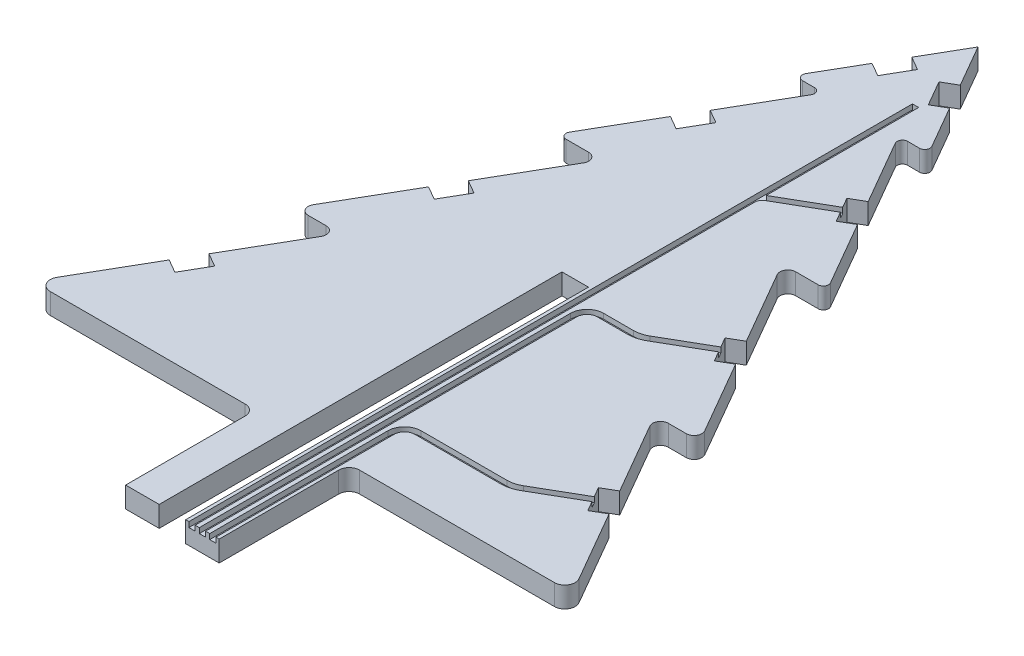
from build123d import *

# Parameters (mm, degrees)
ESBO_O1_W             = 18
ESBO_O1_H             = 25
RVORE_DEPTH           = 4
ESBO_O2_W             = 5.1
ESBO_O2_H             = 77.5
ENCAIXE_DEPTH         = 5
FILETE2_R             = 1
FILETE3_R             = 1
FILETE4_R             = 1
FILETE5_R             = 1
FILETE6_R             = 1
FILETE7_R             = 1
FILETE8_R             = 1.5
FILETE9_R             = 1.5
FILETE10_R            = 1.5
FILETE11_R            = 1.5
FILETE12_R            = 2
FILETE13_R            = 2
FILETE14_R            = 2
FILETE15_R            = 2
FILETE16_R            = 1.5
FILETE17_R            = 1.5
CORTES_DO_LED_DEPTH   = 10
ESBO_O6_W             = 16.486143217
ESBO_O6_H             = 1.199999983
ESBO_O6_W_2           = 1.200000015
ESBO_O6_H_2           = 34.2751352
ESBO_O6_W_3           = 5.711274815
ESBO_O6_H_3           = 1.2
ESBO_O6_W_4           = 1.2
ESBO_O6_H_4           = 71.40185633
CORTE_EXTRUS_O4_DEPTH = 1
FILETE18_R            = 1.5


with BuildPart() as part:
    # Esboço1 → rvore (new body)
    with BuildSketch(Plane(origin=(0, 0, 0), x_dir=(1, 0, 0), z_dir=(0, 1, 0))):
        with Locations((0, -127.5)):
            Rectangle(ESBO_O1_W, ESBO_O1_H)
        Polygon((-51.961524227, -115), (-9, -115), (9, -115), (51.961524227, -115), (30.310889132, -77.5), (-30.310889132, -77.5), align=None)
        Polygon((-8.660254038, -40), (-30.310889132, -77.5), (30.310889132, -77.5), (8.660254038, -40), align=None)
        Polygon((-17.320508076, -40), (-8.660254038, -40), (0, -25), (8.660254038, -40), (17.320508076, -40), (0, -10), align=None)
        Polygon((8.660254038, -40), (30.310889132, -77.5), (38.97114317, -77.5), (17.320508076, -40), align=None)
        Polygon((0, -25), (-8.660254038, -40), (8.660254038, -40), align=None)
        Polygon((-38.97114317, -77.5), (-30.310889132, -77.5), (-8.660254038, -40), (-17.320508076, -40), align=None)
        Polygon((-25.980762114, -40), (-17.320508076, -40), (0, -10), (17.320508076, -40), (25.980762114, -40), (7.216878365, -7.5), (-7.216878365, -7.5), align=None)
        Polygon((0, 5), (-7.216878365, -7.5), (7.216878365, -7.5), align=None)
        Polygon((-12.990381057, -7.5), (-7.216878365, -7.5), (0, 5), (7.216878365, -7.5), (12.990381057, -7.5), (0, 15), align=None)
    extrude(amount=RVORE_DEPTH)

    # Esboço2 → Encaixe (cut)
    with BuildSketch(Plane(origin=(0, 4, 0), x_dir=(1, 0, 0), z_dir=(0, 1, 0))):
        with Locations((0, -101.25)):
            Rectangle(ESBO_O2_W, ESBO_O2_H)
    extrude(amount=-ENCAIXE_DEPTH, mode=Mode.SUBTRACT)

    # Filete2
    filete2_edges = [part.edges().sort_by_distance(p)[0] for p in [
        (12.990381057, 2, 7.5),
    ]]
    fillet(filete2_edges, radius=FILETE2_R)

    # Filete3
    filete3_edges = [part.edges().sort_by_distance(p)[0] for p in [
        (-12.990381057, 2, 7.5),
    ]]
    fillet(filete3_edges, radius=FILETE3_R)

    # Filete4
    filete4_edges = [part.edges().sort_by_distance(p)[0] for p in [
        (-7.216878365, 2, 7.5),
    ]]
    fillet(filete4_edges, radius=FILETE4_R)

    # Filete5
    filete5_edges = [part.edges().sort_by_distance(p)[0] for p in [
        (7.216878365, 2, 7.5),
    ]]
    fillet(filete5_edges, radius=FILETE5_R)

    # Filete6
    filete6_edges = [part.edges().sort_by_distance(p)[0] for p in [
        (25.980762114, 2, 40),
    ]]
    fillet(filete6_edges, radius=FILETE6_R)

    # Filete7
    filete7_edges = [part.edges().sort_by_distance(p)[0] for p in [
        (-25.980762114, 2, 40),
    ]]
    fillet(filete7_edges, radius=FILETE7_R)

    # Filete8
    filete8_edges = [part.edges().sort_by_distance(p)[0] for p in [
        (17.320508076, 2, 40),
    ]]
    fillet(filete8_edges, radius=FILETE8_R)

    # Filete9
    filete9_edges = [part.edges().sort_by_distance(p)[0] for p in [
        (-17.320508076, 2, 40),
    ]]
    fillet(filete9_edges, radius=FILETE9_R)

    # Filete10
    filete10_edges = [part.edges().sort_by_distance(p)[0] for p in [
        (38.97114317, 2, 77.5),
    ]]
    fillet(filete10_edges, radius=FILETE10_R)

    # Filete11
    filete11_edges = [part.edges().sort_by_distance(p)[0] for p in [
        (-38.97114317, 2, 77.5),
    ]]
    fillet(filete11_edges, radius=FILETE11_R)

    # Filete12
    filete12_edges = [part.edges().sort_by_distance(p)[0] for p in [
        (51.961524227, 2, 115),
    ]]
    fillet(filete12_edges, radius=FILETE12_R)

    # Filete13
    filete13_edges = [part.edges().sort_by_distance(p)[0] for p in [
        (-51.961524227, 2, 115),
    ]]
    fillet(filete13_edges, radius=FILETE13_R)

    # Filete14
    filete14_edges = [part.edges().sort_by_distance(p)[0] for p in [
        (9, 2, 115),
    ]]
    fillet(filete14_edges, radius=FILETE14_R)

    # Filete15
    filete15_edges = [part.edges().sort_by_distance(p)[0] for p in [
        (-9, 2, 115),
    ]]
    fillet(filete15_edges, radius=FILETE15_R)

    # Filete16
    filete16_edges = [part.edges().sort_by_distance(p)[0] for p in [
        (30.310889132, 2, 77.5),
    ]]
    fillet(filete16_edges, radius=FILETE16_R)

    # Filete17
    filete17_edges = [part.edges().sort_by_distance(p)[0] for p in [
        (-30.310889132, 2, 77.5),
    ]]
    fillet(filete17_edges, radius=FILETE17_R)

    # Esboço5 → Cortes do Led (cut)
    with BuildSketch(Plane(origin=(0, 4, 0), x_dir=(1, 0, 0), z_dir=(0, 1, 0))):
        Polygon((42.319473419, -98.299478112), (39.519473419, -93.449735851), (36.921397208, -94.949735851), (39.721397208, -99.799478112), align=None)
        Polygon((29.544605065, -61.172757061), (26.744605065, -56.3230148), (24.146528853, -57.8230148), (26.946528853, -62.672757061), align=None)
        Polygon((17.99973671, -26.176458504), (15.19973671, -21.326716243), (12.601660498, -22.826716243), (15.401660498, -27.676458504), align=None)
        Polygon((7.461855653, 2.07568689), (4.661855653, 6.925429151), (2.063779442, 5.425429151), (4.863779442, 0.57568689), align=None)
        Polygon((-7.461855653, 2.07568689), (-4.661855653, 6.925429151), (-2.063779442, 5.425429151), (-4.863779442, 0.57568689), align=None)
        Polygon((-17.99973671, -26.176458504), (-15.19973671, -21.326716243), (-12.601660498, -22.826716243), (-15.401660498, -27.676458504), align=None)
        Polygon((-29.544605065, -61.172757061), (-26.744605065, -56.3230148), (-24.146528853, -57.8230148), (-26.946528853, -62.672757061), align=None)
        Polygon((-42.319473419, -98.299478112), (-39.519473419, -93.449735851), (-36.921397208, -94.949735851), (-39.721397208, -99.799478112), align=None)
    extrude(amount=-CORTES_DO_LED_DEPTH, mode=Mode.SUBTRACT)

    # Esboço6 → Corte-extrusão4 (cut)
    with BuildSketch(Plane(origin=(0, 4, 0), x_dir=(1, 0, 0), z_dir=(0, 1, 0))):
        with BuildLine():
            Line((26.861143157, -102.524864809), (26.861143157, -103.724864792))
            ThreePointArc((26.861143157, -103.724864792), (28.465821261, -103.513604912), (29.96114317, -102.894222224))
            Line((29.96114317, -102.894222224), (29.36114317, -101.854991739))
            ThreePointArc((29.36114317, -101.854991739), (28.155238411, -102.354493936), (26.861143157, -102.524864809))
        make_face()
        with Locations((18.618071549, -103.124864801)):
            Rectangle(ESBO_O6_W, ESBO_O6_H)
        Polygon((38.021397208, -96.854991739), (29.36114317, -101.854991739), (29.96114317, -102.894222224), (38.621397208, -97.894222224), align=None)
        with BuildLine():
            ThreePointArc((10.37499994, -103.724864792), (8.960786372, -104.310651232), (8.375000015, -105.7248648))
            Line((8.375000015, -105.7248648), (7.175, -105.7248648))
            ThreePointArc((7.175, -105.7248648), (8.112258246, -103.462123106), (10.37499994, -102.524864809))
            Line((10.37499994, -102.524864809), (10.37499994, -103.724864792))
        make_face()
        with Locations((7.775000008, -122.8624324)):
            Rectangle(ESBO_O6_W_2, ESBO_O6_H_2)
        Polygon((25.246528853, -59.728270689), (16.586274815, -64.728270689), (17.186274815, -65.767501173), (25.846528853, -60.767501173), align=None)
        with BuildLine():
            Line((14.086274815, -66.59814367), (14.086274815, -65.39814367))
            ThreePointArc((14.086274815, -65.39814367), (15.380370041, -65.227772801), (16.586274815, -64.728270689))
            Line((16.586274815, -64.728270689), (17.186274815, -65.767501173))
            ThreePointArc((17.186274815, -65.767501173), (15.690952895, -66.386883793), (14.086274815, -66.59814367))
        make_face()
        with Locations((11.230637408, -65.99814367)):
            Rectangle(ESBO_O6_W_3, ESBO_O6_H_3)
        with BuildLine():
            ThreePointArc((8.375, -66.59814367), (6.960786438, -67.183930107), (6.375, -68.59814367))
            Line((6.375, -68.59814367), (5.175, -68.59814367))
            ThreePointArc((5.175, -68.59814367), (6.1122583, -66.33540197), (8.375, -65.39814367))
            Line((8.375, -65.39814367), (8.375, -66.59814367))
        make_face()
        with Locations((5.775, -104.299071835)):
            Rectangle(ESBO_O6_W_4, ESBO_O6_H_4)
        Polygon((4.375, -30.116722081), (4.375, -31.502362727), (14.301660498, -25.771202616), (13.701660498, -24.731972131), align=None)
        Polygon((3.175, -0.788496095), (3.175, -140), (4.375, -140), (4.375, -31.502362727), (3.909355653, -31.771202616), (3.309355653, -30.731972131), (4.375, -30.116722081), (4.375, -0.788496095), align=None)
        Polygon((3.909355653, -31.771202616), (4.375, -31.502362727), (4.375, -30.116722081), (3.309355653, -30.731972131), align=None)
    extrude(amount=-CORTE_EXTRUS_O4_DEPTH, mode=Mode.SUBTRACT)

    # Filete18
    filete18_edges = [part.edges().sort_by_distance(p)[0] for p in [
        (4.375, 3.5, 31.502362727),
    ]]
    fillet(filete18_edges, radius=FILETE18_R)


solid = part.part
